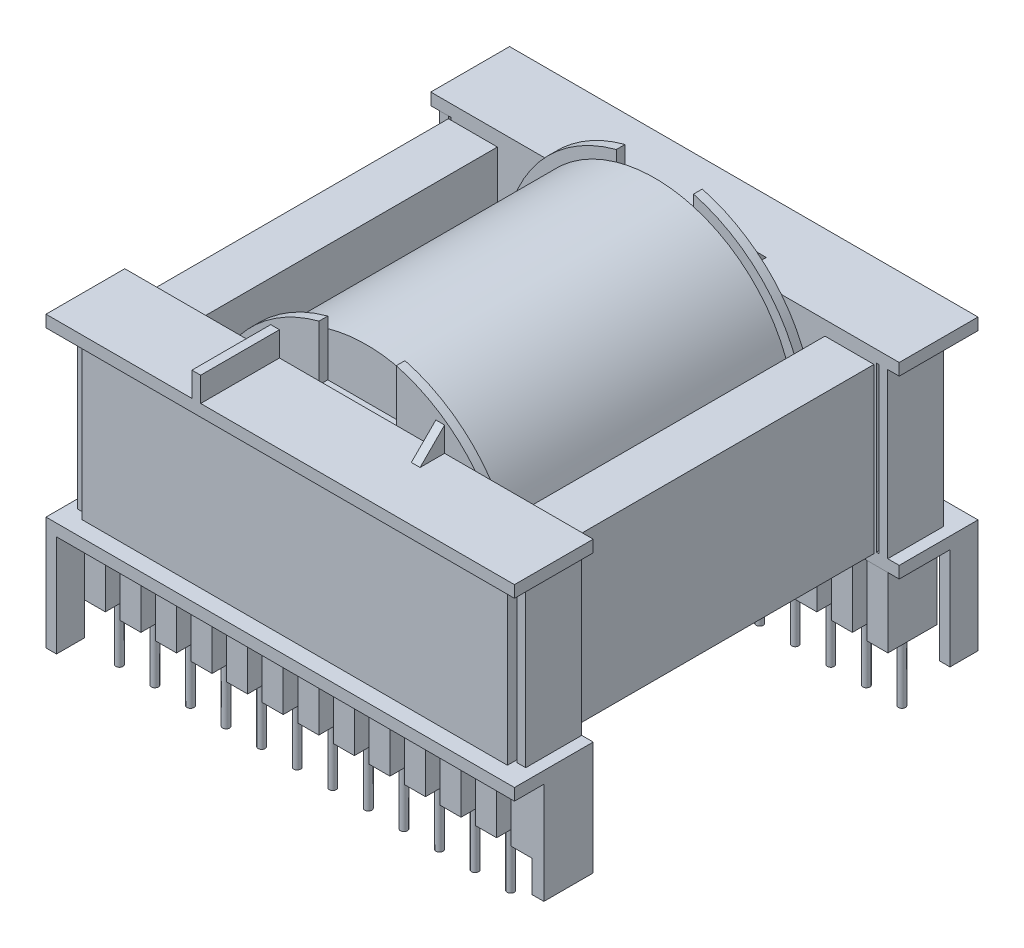
from build123d import *

# Parameters (mm, degrees)
SKETCH_1_R          = 12.45
SKETCH_1_R_2        = 11.6
EXTRUDE_1_DEPTH     = 20.6
SKETCH_2_R          = 11.6
EXTRUDE_2_DEPTH     = 1.25
EXTRUDE_START       = -1.25
SKETCH_3_R          = 11.6
EXTRUDE_3_DEPTH     = 1.25
SKETCH_5_W          = 1.25
SKETCH_5_H          = 23.4
EXTRUDE_4_DEPTH     = 8
EXTRUDE_4_2_DEPTH   = 8
SKETCH_4_W          = 66.9
SKETCH_4_H          = 1.692423433
EXTRUDE_5_DEPTH     = 11.25
SKETCH_6_W          = 1.25
SKETCH_6_H          = 3.5
EXTRUDE_6_DEPTH     = 11.25
SKETCH_7_W          = 1.25
SKETCH_7_H          = 3.5
EXTRUDE_7_DEPTH     = 3.5
CUT_EXTRUDE_1_REACH = 62.364
SKETCH_9_W          = 1.25
SKETCH_9_H          = 23.4
EXTRUDE_8_DEPTH     = 8
EXTRUDE_8_2_DEPTH   = 8
SKETCH_10_W         = 66.9
SKETCH_10_H         = 1.692423433
EXTRUDE_9_DEPTH     = 11.25
SKETCH_11_W         = 1.25
SKETCH_11_H         = 3.5
EXTRUDE_10_DEPTH    = 3.5
CUT_EXTRUDE_2_REACH = 61.715
EXTRUDE_START_2     = 10
SKETCH_15_R         = 0.5
EXTRUDE_11_DEPTH    = 9
EXTRUDE_11_2_DEPTH  = 9
EXTRUDE_11_3_DEPTH  = 9
EXTRUDE_11_4_DEPTH  = 9
EXTRUDE_11_5_DEPTH  = 9
EXTRUDE_11_6_DEPTH  = 9
EXTRUDE_11_7_DEPTH  = 9
EXTRUDE_11_8_DEPTH  = 9
EXTRUDE_11_9_DEPTH  = 9
EXTRUDE_11_10_DEPTH = 9
EXTRUDE_11_11_DEPTH = 9
EXTRUDE_11_12_DEPTH = 9
EXTRUDE_11_13_DEPTH = 9
EXTRUDE_11_14_DEPTH = 9
EXTRUDE_11_15_DEPTH = 9
EXTRUDE_11_16_DEPTH = 9
EXTRUDE_11_17_DEPTH = 9
EXTRUDE_11_18_DEPTH = 9
EXTRUDE_11_19_DEPTH = 9
EXTRUDE_11_20_DEPTH = 9
EXTRUDE_11_21_DEPTH = 9
EXTRUDE_11_22_DEPTH = 9
EXTRUDE_11_23_DEPTH = 9
EXTRUDE_11_24_DEPTH = 9
SKETCH_16_W         = 3
SKETCH_16_H         = 7
EXTRUDE_12_DEPTH    = 10
EXTRUDE_START_3     = 41.2
SKETCH_17_R         = 20
SKETCH_17_R_2       = 12.45
EXTRUDE_13_DEPTH    = 41.2
SKETCH_19_W         = 60.781068966
SKETCH_19_H         = 23.4
EXTRUDE_15_DEPTH    = 9
EXTRUDE_20_DEPTH    = 21.5
EXTRUDE_20_2_DEPTH  = 21.5
SKETCH_22_W         = 60.781068966
SKETCH_22_H         = 23.4
EXTRUDE_21_DEPTH    = 9
SKETCH_24_W         = 1.5
SKETCH_24_H         = 4
SKETCH_24_W_2       = 1.276254773
SKETCH_24_H_2       = 7.05
SKETCH_24_W_3       = 1.663745227
EXTRUDE_25_DEPTH    = 14.5


with BuildPart() as part:
    # Эскиз1 → Бобышка-Вытянуть1 (new, symmetric)
    with BuildSketch(Plane.XY):
        with Locations(Location((0, 0, 0), (0, 0, 180))):
            Circle(SKETCH_1_R)
        with Locations(Location((0, 0, 0), (0, 0, 180))):
            Circle(SKETCH_1_R_2, mode=Mode.SUBTRACT)
    extrude(amount=EXTRUDE_1_DEPTH, both=True)

    # Эскиз2 → Бобышка-Вытянуть2 (add)
    with BuildSketch(Plane.XY.offset(20.6)):
        with BuildLine():
            Line((-5.513787772, 12.892423433), (5.513787772, 12.892423433))
            Line((5.513787772, 12.892423433), (5.513787772, 20.780956292))
            ThreePointArc((5.513787772, 20.780956292), (0, -21.5), (-5.513787772, 20.780956292))
            Line((-5.513787772, 20.780956292), (-5.513787772, 12.892423433))
        make_face()
        with Locations(Location((0, 0, 0), (0, 0, 180))):
            Circle(SKETCH_2_R, mode=Mode.SUBTRACT)
    extrude(amount=EXTRUDE_2_DEPTH)

    # Эскиз3 → Бобышка-Вытянуть3 (add)
    with BuildSketch(Plane.XY.offset(-20.6).offset(EXTRUDE_START)):
        with BuildLine():
            Line((-5.513787772, 12.892423433), (5.513787772, 12.892423433))
            Line((5.513787772, 12.892423433), (5.513787772, 20.780956292))
            ThreePointArc((5.513787772, 20.780956292), (0, -21.5), (-5.513787772, 20.780956292))
            Line((-5.513787772, 20.780956292), (-5.513787772, 12.892423433))
        make_face()
        with Locations(Location((0, 0, 0), (0, 0, 180))):
            Circle(SKETCH_3_R, mode=Mode.SUBTRACT)
    extrude(amount=EXTRUDE_3_DEPTH)



with BuildPart() as body_2:
    # Эскиз5 → Бобышка-Вытянуть4 (new body)
    with BuildSketch(Plane.XY.offset(21.85)):
        with Locations((-31.375, 0)):
            Rectangle(SKETCH_5_W, SKETCH_5_H)
    extrude(amount=EXTRUDE_4_DEPTH)


with BuildPart() as body_3:
    # Эскиз5 → Extrude 4 2 (new body)
    with BuildSketch(Plane.XY.offset(21.85)):
        with Locations((31.375, 0)):
            Rectangle(SKETCH_5_W, SKETCH_5_H)
    extrude(amount=EXTRUDE_4_2_DEPTH)


with BuildPart() as part_1:
    add(part.part)

    add(body_2.part)  # Бобышка-Вытянуть5 merges body 2

    add(body_3.part)  # Бобышка-Вытянуть5 merges body 3
    # Эскиз4 → Бобышка-Вытянуть5 (add)
    with BuildSketch(Plane.XY.offset(21.85)):
        with Locations((0.193745227, 12.546211717)):
            Rectangle(SKETCH_4_W, SKETCH_4_H)
        with Locations((0.193745227, -12.546211717)):
            Rectangle(SKETCH_4_W, SKETCH_4_H)
    extrude(amount=EXTRUDE_5_DEPTH)

    # Эскиз6 → Бобышка-Вытянуть6 (add)
    with BuildSketch(Plane.XY.offset(21.85)):
        with Locations((-11.791605453, 15.142423433)):
            Rectangle(SKETCH_6_W, SKETCH_6_H)
    extrude(amount=EXTRUDE_6_DEPTH)

    # Эскиз7 → Бобышка-Вытянуть7 (add)
    with BuildSketch(Plane.XY.offset(21.85)):
        with Locations((11.791605453, 15.142423433)):
            Rectangle(SKETCH_7_W, SKETCH_7_H)
    extrude(amount=EXTRUDE_7_DEPTH)

    # Эскиз8 → Вырез-Вытянуть1 (cut, up to next)
    with BuildSketch(Plane(origin=(12.416605453, 0, 0), x_dir=(0, 0, -1), z_dir=(1, 0, 0)), mode=Mode.PRIVATE) as cut_extrude_1_sk1:
        Polygon((-21.85, 16.892423433), (-25.35, 13.392423433), (-25.35, 16.892423433), align=None)
    cut_extrude_1_tool1 = extrude(cut_extrude_1_sk1.sketch, amount=-CUT_EXTRUDE_1_REACH, mode=Mode.PRIVATE) & part_1.part
    add(cut_extrude_1_tool1.solids().sort_by_distance((12.416605, 15.725757, 24.183333))[0], mode=Mode.SUBTRACT)



with BuildPart() as body_2_2:
    # Эскиз9 → Бобышка-Вытянуть8 (new body)
    with BuildSketch(Plane(origin=(0, 0, -21.85), x_dir=(-1, 0, 0), z_dir=(0, 0, -1))):
        with Locations((-31.375, 0)):
            Rectangle(SKETCH_9_W, SKETCH_9_H)
    extrude(amount=EXTRUDE_8_DEPTH)


with BuildPart() as body_3_2:
    # Эскиз9 → Extrude 8 2 (new body)
    with BuildSketch(Plane(origin=(0, 0, -21.85), x_dir=(-1, 0, 0), z_dir=(0, 0, -1))):
        with Locations((31.375, 0)):
            Rectangle(SKETCH_9_W, SKETCH_9_H)
    extrude(amount=EXTRUDE_8_2_DEPTH)


with BuildPart() as part_2:
    add(part_1.part)

    add(body_2_2.part)  # Бобышка-Вытянуть9 merges body 2 2
    # Эскиз10 → Бобышка-Вытянуть9 (add)
    with BuildSketch(Plane(origin=(0, 0, -21.85), x_dir=(-1, 0, 0), z_dir=(0, 0, -1))):
        with Locations((-0.193745227, 12.546211717)):
            Rectangle(SKETCH_10_W, SKETCH_10_H)
        with Locations((-0.193745227, -12.546211717)):
            Rectangle(SKETCH_10_W, SKETCH_10_H)
    extrude(amount=EXTRUDE_9_DEPTH)

    # Эскиз11 → Бобышка-Вытянуть10 (add)
    with BuildSketch(Plane(origin=(0, 0, -21.85), x_dir=(-1, 0, 0), z_dir=(0, 0, -1))):
        with Locations((-10.541605453, 15.142423433)):
            Rectangle(SKETCH_11_W, SKETCH_11_H)
        with Locations((10.541605453, 15.142423433)):
            Rectangle(SKETCH_11_W, SKETCH_11_H)
    extrude(amount=EXTRUDE_10_DEPTH)

    # Вырез-Вытянуть2: up to this face of the body (flat: up to its plane)
    cut_extrude_2_end = Plane(part_2.part.faces().sort_by_distance((11.166605453, 15.142423433, -23.6))[0])
    # Эскиз14 → Вырез-Вытянуть2 (cut, up to the picked face)
    with BuildSketch(Plane.ZY.offset(11.166605453), mode=Mode.PRIVATE) as cut_extrude_2_sk1:
        Polygon((-25.35, 16.892423433), (-21.85, 16.892423433), (-25.35, 13.392423433), align=None)
    cut_extrude_2_tool1 = split(extrude(cut_extrude_2_sk1.sketch, amount=-CUT_EXTRUDE_2_REACH, mode=Mode.PRIVATE), bisect_by=cut_extrude_2_end, keep=Keep.BOTH, mode=Mode.PRIVATE)
    add(cut_extrude_2_tool1.solids().sort_by(Axis((-11.166605, 15.725757, -24.183333), (1, 0, 0)))[0], mode=Mode.SUBTRACT)



with BuildPart() as body_3_3:
    # Эскиз15 → Бобышка-Вытянуть11 (new body)
    with BuildSketch(Plane.XZ.offset(13.392423433).offset(EXTRUDE_START_2)):
        with Locations(Location((25.4, 25.4, 0), (0, 0, 270))):
            Circle(SKETCH_15_R)
    extrude(amount=EXTRUDE_11_DEPTH)


with BuildPart() as body_4:
    # Эскиз15 → Extrude 11 2 (new body)
    with BuildSketch(Plane.XZ.offset(13.392423433).offset(EXTRUDE_START_2)):
        with Locations(Location((20.32, 25.4, 0), (0, 0, 270))):
            Circle(SKETCH_15_R)
    extrude(amount=EXTRUDE_11_2_DEPTH)


with BuildPart() as body_5:
    # Эскиз15 → Extrude 11 3 (new body)
    with BuildSketch(Plane.XZ.offset(13.392423433).offset(EXTRUDE_START_2)):
        with Locations(Location((30.48, -25.4, 0), (0, 0, 270))):
            Circle(SKETCH_15_R)
    extrude(amount=EXTRUDE_11_3_DEPTH)


with BuildPart() as body_6:
    # Эскиз15 → Extrude 11 4 (new body)
    with BuildSketch(Plane.XZ.offset(13.392423433).offset(EXTRUDE_START_2)):
        with Locations(Location((25.4, -25.4, 0), (0, 0, 270))):
            Circle(SKETCH_15_R)
    extrude(amount=EXTRUDE_11_4_DEPTH)


with BuildPart() as body_7:
    # Эскиз15 → Extrude 11 5 (new body)
    with BuildSketch(Plane.XZ.offset(13.392423433).offset(EXTRUDE_START_2)):
        with Locations(Location((20.32, -25.4, 0), (0, 0, 270))):
            Circle(SKETCH_15_R)
    extrude(amount=EXTRUDE_11_5_DEPTH)


with BuildPart() as body_8:
    # Эскиз15 → Extrude 11 6 (new body)
    with BuildSketch(Plane.XZ.offset(13.392423433).offset(EXTRUDE_START_2)):
        with Locations(Location((15.24, -25.4, 0), (0, 0, 270))):
            Circle(SKETCH_15_R)
    extrude(amount=EXTRUDE_11_6_DEPTH)


with BuildPart() as body_9:
    # Эскиз15 → Extrude 11 7 (new body)
    with BuildSketch(Plane.XZ.offset(13.392423433).offset(EXTRUDE_START_2)):
        with Locations(Location((10.16, -25.4, 0), (0, 0, 270))):
            Circle(SKETCH_15_R)
    extrude(amount=EXTRUDE_11_7_DEPTH)


with BuildPart() as body_10:
    # Эскиз15 → Extrude 11 8 (new body)
    with BuildSketch(Plane.XZ.offset(13.392423433).offset(EXTRUDE_START_2)):
        with Locations(Location((5.08, -25.4, 0), (0, 0, 270))):
            Circle(SKETCH_15_R)
    extrude(amount=EXTRUDE_11_8_DEPTH)


with BuildPart() as body_11:
    # Эскиз15 → Extrude 11 9 (new body)
    with BuildSketch(Plane.XZ.offset(13.392423433).offset(EXTRUDE_START_2)):
        with Locations(Location((0, -25.4, 0), (0, 0, 270))):
            Circle(SKETCH_15_R)
    extrude(amount=EXTRUDE_11_9_DEPTH)


with BuildPart() as body_12:
    # Эскиз15 → Extrude 11 10 (new body)
    with BuildSketch(Plane.XZ.offset(13.392423433).offset(EXTRUDE_START_2)):
        with Locations(Location((-5.08, -25.4, 0), (0, 0, 270))):
            Circle(SKETCH_15_R)
    extrude(amount=EXTRUDE_11_10_DEPTH)


with BuildPart() as body_13:
    # Эскиз15 → Extrude 11 11 (new body)
    with BuildSketch(Plane.XZ.offset(13.392423433).offset(EXTRUDE_START_2)):
        with Locations(Location((-10.16, -25.4, 0), (0, 0, 270))):
            Circle(SKETCH_15_R)
    extrude(amount=EXTRUDE_11_11_DEPTH)


with BuildPart() as body_14:
    # Эскиз15 → Extrude 11 12 (new body)
    with BuildSketch(Plane.XZ.offset(13.392423433).offset(EXTRUDE_START_2)):
        with Locations(Location((-15.24, -25.4, 0), (0, 0, 270))):
            Circle(SKETCH_15_R)
    extrude(amount=EXTRUDE_11_12_DEPTH)


with BuildPart() as body_15:
    # Эскиз15 → Extrude 11 13 (new body)
    with BuildSketch(Plane.XZ.offset(13.392423433).offset(EXTRUDE_START_2)):
        with Locations(Location((-20.32, -25.4, 0), (0, 0, 270))):
            Circle(SKETCH_15_R)
    extrude(amount=EXTRUDE_11_13_DEPTH)


with BuildPart() as body_16:
    # Эскиз15 → Extrude 11 14 (new body)
    with BuildSketch(Plane.XZ.offset(13.392423433).offset(EXTRUDE_START_2)):
        with Locations(Location((-25.4, -25.4, 0), (0, 0, 270))):
            Circle(SKETCH_15_R)
    extrude(amount=EXTRUDE_11_14_DEPTH)


with BuildPart() as body_17:
    # Эскиз15 → Extrude 11 15 (new body)
    with BuildSketch(Plane.XZ.offset(13.392423433).offset(EXTRUDE_START_2)):
        with Locations(Location((15.24, 25.4, 0), (0, 0, 90))):
            Circle(SKETCH_15_R)
    extrude(amount=EXTRUDE_11_15_DEPTH)


with BuildPart() as body_18:
    # Эскиз15 → Extrude 11 16 (new body)
    with BuildSketch(Plane.XZ.offset(13.392423433).offset(EXTRUDE_START_2)):
        with Locations(Location((10.16, 25.4, 0), (0, 0, 90))):
            Circle(SKETCH_15_R)
    extrude(amount=EXTRUDE_11_16_DEPTH)


with BuildPart() as body_19:
    # Эскиз15 → Extrude 11 17 (new body)
    with BuildSketch(Plane.XZ.offset(13.392423433).offset(EXTRUDE_START_2)):
        with Locations(Location((5.08, 25.4, 0), (0, 0, 90))):
            Circle(SKETCH_15_R)
    extrude(amount=EXTRUDE_11_17_DEPTH)


with BuildPart() as body_20:
    # Эскиз15 → Extrude 11 18 (new body)
    with BuildSketch(Plane.XZ.offset(13.392423433).offset(EXTRUDE_START_2)):
        with Locations(Location((0, 25.4, 0), (0, 0, 90))):
            Circle(SKETCH_15_R)
    extrude(amount=EXTRUDE_11_18_DEPTH)


with BuildPart() as body_21:
    # Эскиз15 → Extrude 11 19 (new body)
    with BuildSketch(Plane.XZ.offset(13.392423433).offset(EXTRUDE_START_2)):
        with Locations(Location((-5.08, 25.4, 0), (0, 0, 90))):
            Circle(SKETCH_15_R)
    extrude(amount=EXTRUDE_11_19_DEPTH)


with BuildPart() as body_22:
    # Эскиз15 → Extrude 11 20 (new body)
    with BuildSketch(Plane.XZ.offset(13.392423433).offset(EXTRUDE_START_2)):
        with Locations(Location((-10.16, 25.4, 0), (0, 0, 90))):
            Circle(SKETCH_15_R)
    extrude(amount=EXTRUDE_11_20_DEPTH)


with BuildPart() as body_23:
    # Эскиз15 → Extrude 11 21 (new body)
    with BuildSketch(Plane.XZ.offset(13.392423433).offset(EXTRUDE_START_2)):
        with Locations(Location((-15.24, 25.4, 0), (0, 0, 90))):
            Circle(SKETCH_15_R)
    extrude(amount=EXTRUDE_11_21_DEPTH)


with BuildPart() as body_24:
    # Эскиз15 → Extrude 11 22 (new body)
    with BuildSketch(Plane.XZ.offset(13.392423433).offset(EXTRUDE_START_2)):
        with Locations(Location((-20.32, 25.4, 0), (0, 0, 90))):
            Circle(SKETCH_15_R)
    extrude(amount=EXTRUDE_11_22_DEPTH)


with BuildPart() as body_25:
    # Эскиз15 → Extrude 11 23 (new body)
    with BuildSketch(Plane.XZ.offset(13.392423433).offset(EXTRUDE_START_2)):
        with Locations(Location((-25.4, 25.4, 0), (0, 0, 90))):
            Circle(SKETCH_15_R)
    extrude(amount=EXTRUDE_11_23_DEPTH)


with BuildPart() as body_26:
    # Эскиз15 → Extrude 11 24 (new body)
    with BuildSketch(Plane.XZ.offset(13.392423433).offset(EXTRUDE_START_2)):
        with Locations(Location((-30.48, 25.4, 0), (0, 0, 90))):
            Circle(SKETCH_15_R)
    extrude(amount=EXTRUDE_11_24_DEPTH)


with BuildPart() as part_3:
    add(part_2.part)

    add(body_3_3.part)  # Бобышка-Вытянуть12 merges body 3 3

    add(body_4.part)  # Бобышка-Вытянуть12 merges body 4

    add(body_5.part)  # Бобышка-Вытянуть12 merges body 5

    add(body_6.part)  # Бобышка-Вытянуть12 merges body 6

    add(body_7.part)  # Бобышка-Вытянуть12 merges body 7

    add(body_8.part)  # Бобышка-Вытянуть12 merges body 8

    add(body_9.part)  # Бобышка-Вытянуть12 merges body 9

    add(body_10.part)  # Бобышка-Вытянуть12 merges body 10

    add(body_11.part)  # Бобышка-Вытянуть12 merges body 11

    add(body_12.part)  # Бобышка-Вытянуть12 merges body 12

    add(body_13.part)  # Бобышка-Вытянуть12 merges body 13

    add(body_14.part)  # Бобышка-Вытянуть12 merges body 14

    add(body_15.part)  # Бобышка-Вытянуть12 merges body 15

    add(body_16.part)  # Бобышка-Вытянуть12 merges body 16

    add(body_17.part)  # Бобышка-Вытянуть12 merges body 17

    add(body_18.part)  # Бобышка-Вытянуть12 merges body 18

    add(body_19.part)  # Бобышка-Вытянуть12 merges body 19

    add(body_20.part)  # Бобышка-Вытянуть12 merges body 20

    add(body_21.part)  # Бобышка-Вытянуть12 merges body 21

    add(body_22.part)  # Бобышка-Вытянуть12 merges body 22

    add(body_23.part)  # Бобышка-Вытянуть12 merges body 23

    add(body_24.part)  # Бобышка-Вытянуть12 merges body 24

    add(body_25.part)  # Бобышка-Вытянуть12 merges body 25

    add(body_26.part)  # Бобышка-Вытянуть12 merges body 26
    # Эскиз16 → Бобышка-Вытянуть12 (add)
    with BuildSketch(Plane.XZ.offset(13.392423433)):
        with Locations((30.48, -25.4)):
            Rectangle(SKETCH_16_W, SKETCH_16_H)
        with Locations((5.08, -25.4)):
            Rectangle(SKETCH_16_W, SKETCH_16_H)
        with Locations((0, -25.4)):
            Rectangle(SKETCH_16_W, SKETCH_16_H)
        with Locations((-10.16, -25.4)):
            Rectangle(SKETCH_16_W, SKETCH_16_H)
        with Locations((-15.24, -25.4)):
            Rectangle(SKETCH_16_W, SKETCH_16_H)
        with Locations((-20.32, -25.4)):
            Rectangle(SKETCH_16_W, SKETCH_16_H)
        with Locations((-25.4, -25.4)):
            Rectangle(SKETCH_16_W, SKETCH_16_H)
        with Locations((-30.48, -25.4)):
            Rectangle(SKETCH_16_W, SKETCH_16_H)
        with Locations((-30.48, 25.4)):
            Rectangle(SKETCH_16_W, SKETCH_16_H)
        with Locations((-25.4, 25.4)):
            Rectangle(SKETCH_16_W, SKETCH_16_H)
        with Locations((-20.32, 25.4)):
            Rectangle(SKETCH_16_W, SKETCH_16_H)
        with Locations((-15.24, 25.4)):
            Rectangle(SKETCH_16_W, SKETCH_16_H)
        with Locations((-10.16, 25.4)):
            Rectangle(SKETCH_16_W, SKETCH_16_H)
        with Locations((-5.08, 25.4)):
            Rectangle(SKETCH_16_W, SKETCH_16_H)
        with Locations((0, 25.4)):
            Rectangle(SKETCH_16_W, SKETCH_16_H)
        with Locations((5.08, 25.4)):
            Rectangle(SKETCH_16_W, SKETCH_16_H)
        with Locations((10.16, 25.4)):
            Rectangle(SKETCH_16_W, SKETCH_16_H)
        with Locations((15.24, 25.4)):
            Rectangle(SKETCH_16_W, SKETCH_16_H)
        with Locations((20.32, 25.4)):
            Rectangle(SKETCH_16_W, SKETCH_16_H)
        with Locations((30.48, 25.4)):
            Rectangle(SKETCH_16_W, SKETCH_16_H)
        with Locations((25.4, 25.4)):
            Rectangle(SKETCH_16_W, SKETCH_16_H)
        with Locations((25.4, -25.4)):
            Rectangle(SKETCH_16_W, SKETCH_16_H)
        with Locations((20.32, -25.4)):
            Rectangle(SKETCH_16_W, SKETCH_16_H)
        with Locations((15.24, -25.4)):
            Rectangle(SKETCH_16_W, SKETCH_16_H)
        with Locations((10.16, -25.4)):
            Rectangle(SKETCH_16_W, SKETCH_16_H)
        with Locations((-5.08, -25.4)):
            Rectangle(SKETCH_16_W, SKETCH_16_H)
    extrude(amount=EXTRUDE_12_DEPTH)

    # Эскиз17 → Бобышка-Вытянуть13 (add)
    with BuildSketch(Plane.XY.offset(-20.6).offset(EXTRUDE_START_3)):
        with Locations(Location((0, 0, 0), (0, 0, 106.003101425))):
            Circle(SKETCH_17_R)
        Circle(SKETCH_17_R_2, mode=Mode.SUBTRACT)
    extrude(amount=-EXTRUDE_13_DEPTH)

    # Эскиз19 → Бобышка-Вытянуть15 (add)
    with BuildSketch(Plane.XY.offset(21.85)):
        Rectangle(SKETCH_19_W, SKETCH_19_H)
    extrude(amount=EXTRUDE_15_DEPTH)

    # Эскиз22 → Бобышка-Вытянуть21 (add)
    with BuildSketch(Plane(origin=(0, 0, -21.85), x_dir=(-1, 0, 0), z_dir=(0, 0, -1))):
        Rectangle(SKETCH_22_W, SKETCH_22_H)
    extrude(amount=EXTRUDE_21_DEPTH)

    # Эскиз24 → Бобышка-Вытянуть25 (add)
    with BuildSketch(Plane.XZ.offset(13.392423433)):
        with Locations((-32.506254773, 31.1)):
            Rectangle(SKETCH_24_W, SKETCH_24_H)
        with Locations((32.893745227, -31.1)):
            Rectangle(SKETCH_24_W, SKETCH_24_H)
        with Locations((-32.618127386, -25.375)):
            Rectangle(SKETCH_24_W_2, SKETCH_24_H_2)
        with Locations((32.811872614, 25.375)):
            Rectangle(SKETCH_24_W_3, SKETCH_24_H_2)
    extrude(amount=EXTRUDE_25_DEPTH)


with BuildPart() as body_3_4:
    # Эскиз21 → Бобышка-Вытянуть20 (new, symmetric)
    with BuildSketch(Plane(origin=(0, 0, 0), x_dir=(-1, 0, 0), z_dir=(0, 0, -1))):
        Polygon((-30.390534483, 11.7), (-23.390534483, 11.7), (-23.390534483, 0), (-23.390534483, -11.7), (-30.390534483, -11.7), (-30.390534483, 0), align=None)
    extrude(amount=EXTRUDE_20_DEPTH, both=True)


with BuildPart() as body_4_2:
    # Эскиз21 → Extrude 20 2 (new, symmetric)
    with BuildSketch(Plane(origin=(0, 0, 0), x_dir=(-1, 0, 0), z_dir=(0, 0, -1))):
        Polygon((30.390534483, 11.7), (23.390534483, 11.7), (23.390534483, 0), (23.390534483, -11.7), (30.390534483, -11.7), (30.390534483, 0), align=None)
    extrude(amount=EXTRUDE_20_2_DEPTH, both=True)


solid = Compound([body_3_2.part, part_3.part, body_3_4.part, body_4_2.part])
